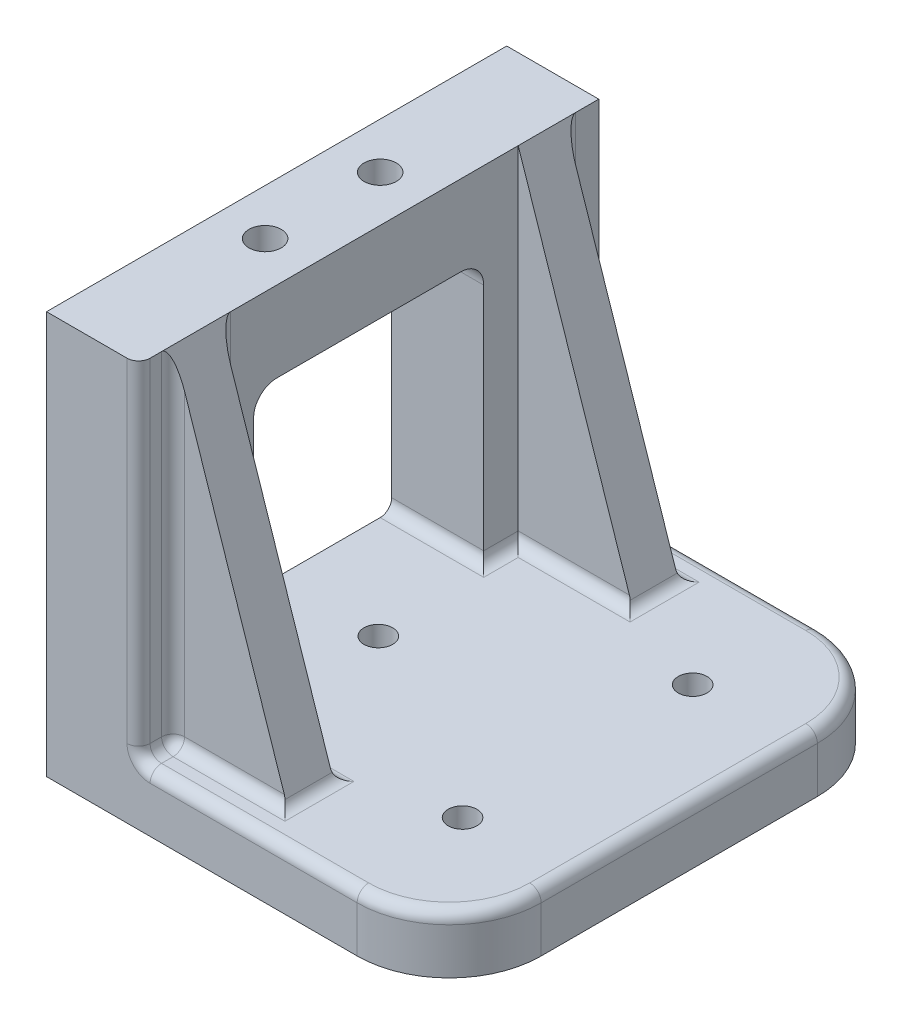
from build123d import *

# Parameters (mm, degrees)
SKETCH1_W           = 35
SKETCH1_H           = 40
SKETCH1_R           = 1.25
BOSS_EXTRUDE1_DEPTH = 5
FILLET1_R           = 8
FILLET2_R           = 8
SKETCH2_W           = 8
SKETCH2_H           = 10
BOSS_EXTRUDE2_DEPTH = 30
RIB1_REACH          = 62.622
SKETCH4_WALL_W      = 154.866333132
SKETCH4_WALL_H      = 4
BOSS_EXTRUDE3_REACH = 59.879
SKETCH5_W           = 8
SKETCH5_H           = 7
CUT_EXTRUDE1_REACH  = 65.64
SKETCH6_R           = 1.4
FILLET7_R           = 1
FILLET8_R           = 2


with BuildPart() as part:
    # Sketch1 → Boss-Extrude1 (new body)
    with BuildSketch(Plane(origin=(0, 0, 0), x_dir=(1, 0, 0), z_dir=(0, 1, 0))):
        with Locations((17.5, 20)):
            Rectangle(SKETCH1_W, SKETCH1_H)
        with Locations(Location((26.160254038, 30, 0), (0, 0, 270))):
            Circle(SKETCH1_R, mode=Mode.SUBTRACT)
        with Locations(Location((8.839745962, 20, 0), (0, 0, 270))):
            Circle(SKETCH1_R, mode=Mode.SUBTRACT)
        with Locations(Location((26.160254038, 10, 0), (0, 0, 270))):
            Circle(SKETCH1_R, mode=Mode.SUBTRACT)
    extrude(amount=BOSS_EXTRUDE1_DEPTH)

    # Fillet1
    fillet1_edges = [part.edges().sort_by_distance(p)[0] for p in [
        (35, 2.5, 0),
    ]]
    fillet(fillet1_edges, radius=FILLET1_R)

    # Fillet2
    fillet2_edges = [part.edges().sort_by_distance(p)[0] for p in [
        (35, 2.5, -40),
    ]]
    fillet(fillet2_edges, radius=FILLET2_R)

    # Sketch2 → Boss-Extrude2 (add)
    with BuildSketch(Plane(origin=(0, 5, 0), x_dir=(1, 0, 0), z_dir=(0, 1, 0))):
        with Locations((4, 5)):
            Rectangle(SKETCH2_W, SKETCH2_H)
        with Locations((4, 35)):
            Rectangle(SKETCH2_W, SKETCH2_H)
    extrude(amount=BOSS_EXTRUDE2_DEPTH)

    # Sketch4 wall → Rib1 (add, up to next)
    with BuildSketch(Plane(origin=(13, 20, -5), x_dir=(0.316227766017, -0.948683298051, 0), z_dir=(0.948683298051, 0.316227766017, 0)), mode=Mode.PRIVATE) as rib1_sk1:
        Rectangle(SKETCH4_WALL_W, SKETCH4_WALL_H)
    rib1_tool1 = extrude(rib1_sk1.sketch, amount=-RIB1_REACH, mode=Mode.PRIVATE) - part.part
    rib1 = rib1_tool1.solids().sort_by_distance((13, 20, -5))[0]
    add(rib1)

    # Mirror2: Rib1 across plane
    add(rib1.mirror(Plane(origin=(0, 0, -20), x_dir=(1, 0, 0), z_dir=(0, 0, -1))))

    # Sketch5 → Boss-Extrude3 (add, up to next)
    with BuildSketch(Plane.XY.offset(-30), mode=Mode.PRIVATE) as boss_extrude3_sk1:
        with Locations((4, 31.5)):
            Rectangle(SKETCH5_W, SKETCH5_H)
    boss_extrude3_tool1 = extrude(boss_extrude3_sk1.sketch, amount=BOSS_EXTRUDE3_REACH, mode=Mode.PRIVATE) - part.part
    add(boss_extrude3_tool1.solids().sort_by_distance((4, 31.5, -30))[0])

    # Sketch6 → Cut-Extrude1 (cut, up to next)
    with BuildSketch(Plane(origin=(0, 35, 0), x_dir=(1, 0, 0), z_dir=(0, 1, 0)), mode=Mode.PRIVATE) as cut_extrude1_sk1:
        with Locations(Location((4, 15, 0), (0, 0, 270))):
            Circle(SKETCH6_R)
    cut_extrude1_tool1 = extrude(cut_extrude1_sk1.sketch, amount=-CUT_EXTRUDE1_REACH, mode=Mode.PRIVATE) & part.part
    # Sketch6 → Cut-Extrude1 (cut, up to next)
    with BuildSketch(Plane(origin=(0, 35, 0), x_dir=(1, 0, 0), z_dir=(0, 1, 0)), mode=Mode.PRIVATE) as cut_extrude1_sk2:
        with Locations(Location((4, 25, 0), (0, 0, 270))):
            Circle(SKETCH6_R)
    cut_extrude1_tool2 = extrude(cut_extrude1_sk2.sketch, amount=-CUT_EXTRUDE1_REACH, mode=Mode.PRIVATE) & part.part
    add(cut_extrude1_tool1.solids().sort_by_distance((4, 35, -15))[0], mode=Mode.SUBTRACT)
    add(cut_extrude1_tool2.solids().sort_by_distance((4, 35, -25))[0], mode=Mode.SUBTRACT)

    # Fillet7
    fillet7_edges = [part.edges().sort_by_distance(p)[0] for p in [
        (8, 20, 0),
        (32.656854249, 5, -37.656854249),
        (17.5, 5, -40),
        (8, 20, -37),
        (13, 5, -37),
        (18, 5, -35),
        (13, 5, -33),
        (8, 5, -31.5),
        (4, 5, -30),
        (4, 5, -10),
        (8, 5, -8.5),
        (35, 5, -20),
        (32.656854249, 5, -2.343145751),
        (8, 20, -3),
        (8, 20, -7),
        (13, 5, -7),
        (18, 5, -5),
        (13, 5, -3),
        (17.5, 5, 0),
        (8, 5, -1.5),
    ]]
    fillet(fillet7_edges, radius=FILLET7_R)

    # Fillet8
    fillet8_edges = [part.edges().sort_by_distance(p)[0] for p in [
        (4, 28, -10),
        (4, 28, -30),
    ]]
    fillet(fillet8_edges, radius=FILLET8_R)


solid = part.part
